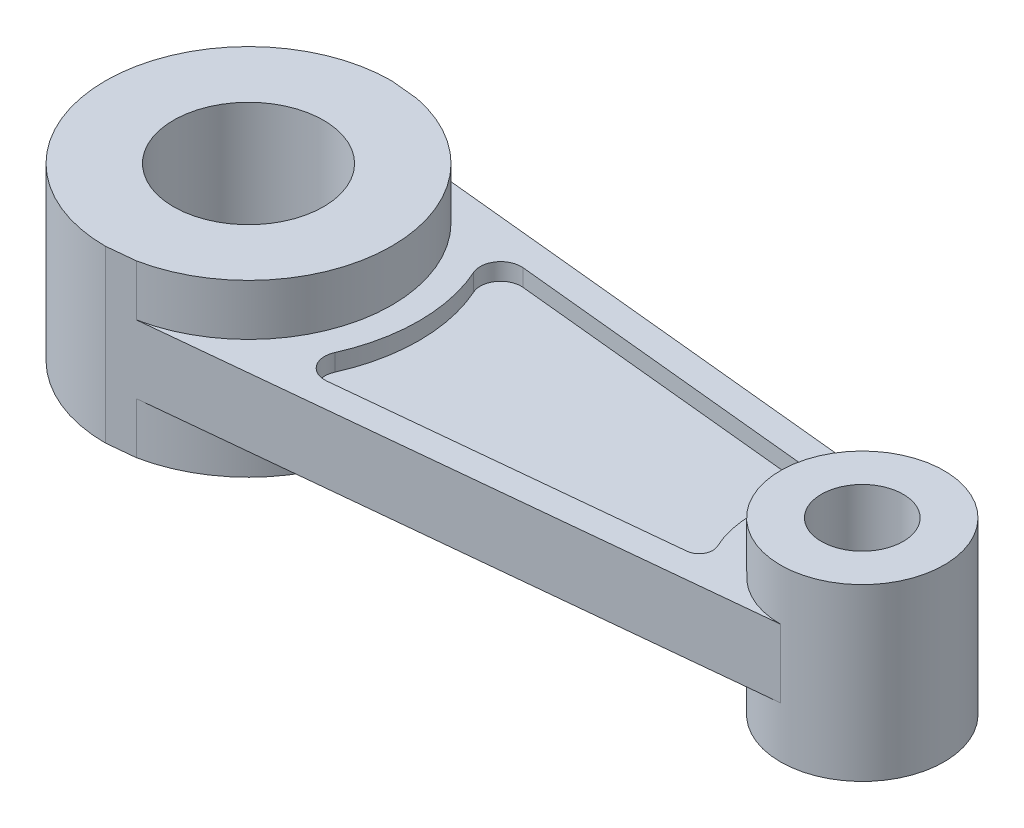
from build123d import *

# Parameters (mm, degrees)
SKETCH2_R             = 11
BOSS_EXTRUDE1_DEPTH   = 12.5
SKETCH2_R_2           = 12
SKETCH2_R_3           = 6
BOSS_EXTRUDE1_2_DEPTH = 12.5
BOSS_EXTRUDE2_DEPTH   = 5
BOSS_EXTRUDE3_DEPTH   = 2.5


with BuildPart() as part:
    # Sketch2 → Boss-Extrude1 (new, symmetric)
    with BuildSketch(Plane(origin=(0, 0, 0), x_dir=(1, 0, 0), z_dir=(0, 1, 0))):
        with BuildLine():
            ThreePointArc((-33.466351399, 21), (-54.466351399, 0), (-33.466351399, -21))
            Line((-33.466351399, -21), (-29.307935557, -20.584158416))
            ThreePointArc((-29.307935557, -20.584158416), (-12.466351399, 0), (-29.307935557, 20.584158416))
            Line((-29.307935557, 20.584158416), (-33.466351399, 21))
        make_face()
        with Locations((-33.466351399, 0)):
            Circle(SKETCH2_R, mode=Mode.SUBTRACT)
    extrude(amount=BOSS_EXTRUDE1_DEPTH, both=True)



with BuildPart() as body_2:
    # Sketch2 → Boss-Extrude1 2 (new, symmetric)
    with BuildSketch(Plane(origin=(0, 0, 0), x_dir=(1, 0, 0), z_dir=(0, 1, 0))):
        with Locations((56.533648601, 0)):
            Circle(SKETCH2_R_2)
        with Locations((56.533648601, 0)):
            Circle(SKETCH2_R_3, mode=Mode.SUBTRACT)
    extrude(amount=BOSS_EXTRUDE1_2_DEPTH, both=True)


with BuildPart() as part_1:
    add(part.part)

    add(body_2.part)  # Boss-Extrude2 merges body 2
    # Sketch2<3> → Boss-Extrude2 (add, symmetric)
    with BuildSketch(Plane(origin=(0, 0, 0), x_dir=(1, 0, 0), z_dir=(0, 1, 0))):
        with BuildLine():
            ThreePointArc((-12.466351399, 0), (-17.213248116, -13.297993595), (-29.307935557, -20.584158416))
            Line((-29.307935557, -20.584158416), (56.533648601, -12))
            ThreePointArc((56.533648601, -12), (44.533648601, 0), (56.533648601, 12))
            Line((56.533648601, 12), (-29.307935557, 20.584158416))
            ThreePointArc((-29.307935557, 20.584158416), (-17.213248116, 13.297993595), (-12.466351399, 0))
        make_face()
        with BuildLine():
            ThreePointArc((-10.635434162, 10.185736013), (-10.327887019, 13.164322574), (-7.597212937, 14.393135905))
            Line((-7.597212937, 14.393135905), (40.416577367, 9.591756875))
            ThreePointArc((40.416577367, 9.591756875), (41.955623351, 8.591212838), (42.030467559, 6.757051106))
            ThreePointArc((42.030467559, 6.757051106), (40.533648601, 0), (42.030467559, -6.757051106))
            ThreePointArc((42.030467559, -6.757051106), (41.955623351, -8.591212838), (40.416577367, -9.591756875))
            Line((40.416577367, -9.591756875), (-7.597212937, -14.393135905))
            ThreePointArc((-7.597212937, -14.393135905), (-10.327887019, -13.164322574), (-10.635434162, -10.185736013))
            ThreePointArc((-10.635434162, -10.185736013), (-8.466351399, 0), (-10.635434162, 10.185736013))
        make_face(mode=Mode.SUBTRACT)
    extrude(amount=BOSS_EXTRUDE2_DEPTH, both=True)

    # Sketch2<4> → Boss-Extrude3 (add, symmetric)
    with BuildSketch(Plane(origin=(0, 0, 0), x_dir=(1, 0, 0), z_dir=(0, 1, 0))):
        with BuildLine():
            Line((-7.597212937, 14.393135905), (40.416577367, 9.591756875))
            ThreePointArc((40.416577367, 9.591756875), (41.955623351, 8.591212838), (42.030467559, 6.757051106))
            ThreePointArc((42.030467559, 6.757051106), (40.533648601, 0), (42.030467559, -6.757051106))
            ThreePointArc((42.030467559, -6.757051106), (41.955623351, -8.591212838), (40.416577367, -9.591756875))
            Line((40.416577367, -9.591756875), (-7.597212937, -14.393135905))
            ThreePointArc((-7.597212937, -14.393135905), (-10.327887019, -13.164322574), (-10.635434162, -10.185736013))
            ThreePointArc((-10.635434162, -10.185736013), (-8.466351399, 0), (-10.635434162, 10.185736013))
            ThreePointArc((-10.635434162, 10.185736013), (-10.327887019, 13.164322574), (-7.597212937, 14.393135905))
        make_face()
    extrude(amount=BOSS_EXTRUDE3_DEPTH, both=True)


solid = part_1.part
